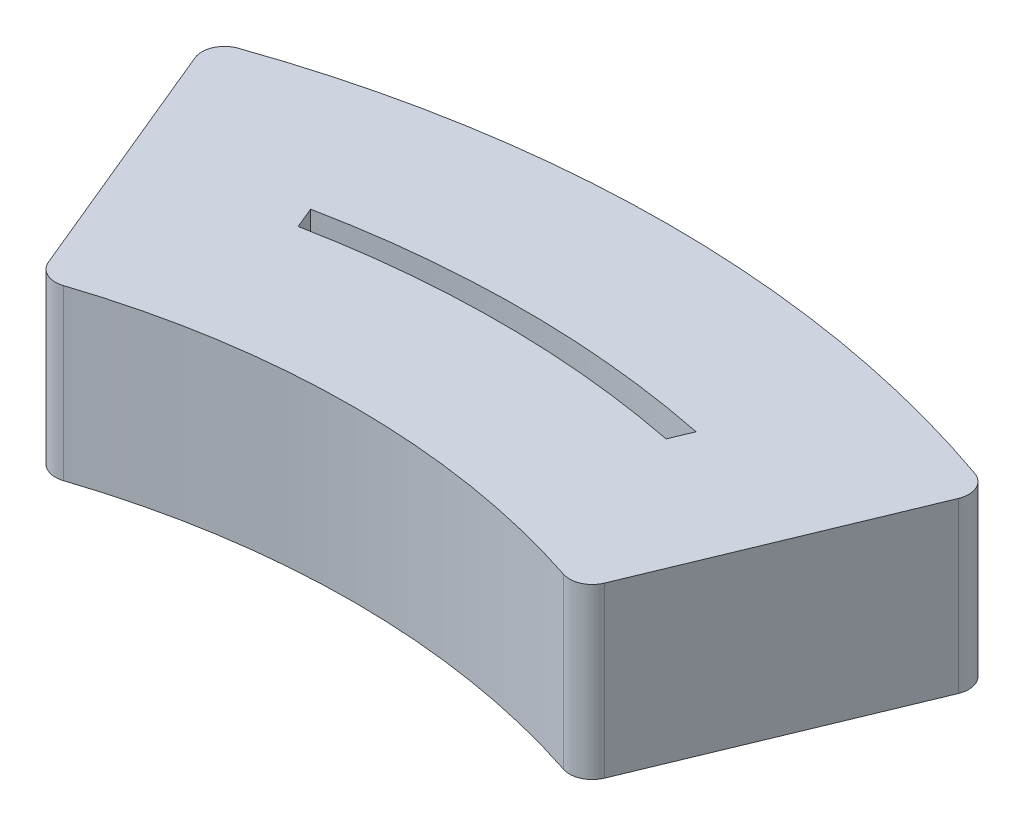
from build123d import *

# Parameters (mm, degrees)
BOSS_EXTRUDE1_DEPTH = 37.5


with BuildPart() as part:
    # Sketch1 → Boss-Extrude1 (new, symmetric)
    with BuildSketch(Plane(origin=(0, 0, 0), x_dir=(1, 0, 0), z_dir=(0, 1, 0))):
        with BuildLine():
            Line((-169.201674923, 40.249068867), (-123.18328996, -70.849140229))
            ThreePointArc((-123.18328996, -70.849140229), (-118.113327011, -76.111906371), (-110.817156223, -76.520713901))
            ThreePointArc((-110.817156223, -76.520713901), (0.203357417, -58.714197752), (111.223871056, -76.520713901))
            ThreePointArc((111.223871056, -76.520713901), (118.520041845, -76.111906371), (123.590004794, -70.849140229))
            Line((123.590004794, -70.849140229), (169.608389757, 40.249068867))
            ThreePointArc((169.608389757, 40.249068867), (169.497341838, 48.160536257), (163.671991071, 53.514874344))
            ThreePointArc((163.671991071, 53.514874344), (0.203357417, 81.285802248), (-163.265276237, 53.514874344))
            ThreePointArc((-163.265276237, 53.514874344), (-169.090627004, 48.160536257), (-169.201674923, 40.249068867))
        make_face()
        with BuildLine():
            Line((-85.358619183, 7.687212023), (-81.458097216, -1.729481012))
            ThreePointArc((-81.458097216, -1.729481012), (0.203357417, 6.285802248), (81.864812049, -1.729481012))
            Line((81.864812049, -1.729481012), (85.765334017, 7.687212023))
            ThreePointArc((85.765334017, 7.687212023), (0.203357417, 16.285802248), (-85.358619183, 7.687212023))
        make_face(mode=Mode.SUBTRACT)
    extrude(amount=BOSS_EXTRUDE1_DEPTH, both=True)


solid = part.part
